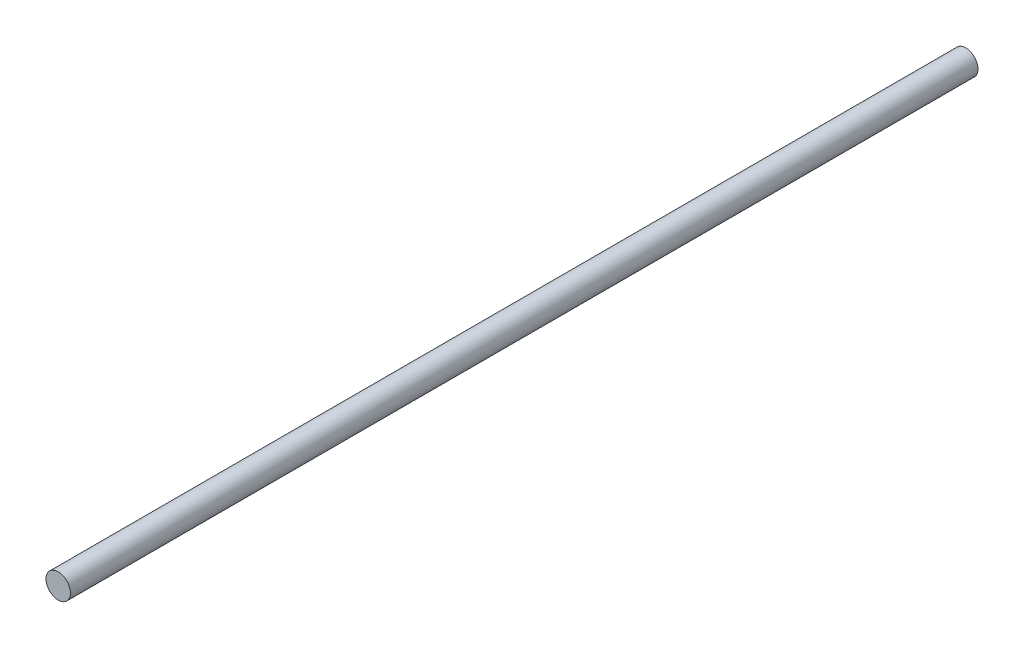
from build123d import *

# Parameters (mm, degrees)
SKETCH1_R           = 3
BOSS_EXTRUDE2_DEPTH = 4.5
SKETCH3_R           = 3
BOSS_EXTRUDE3_DEPTH = 201
SKETCH4_R           = 3
BOSS_EXTRUDE4_DEPTH = 17


with BuildPart() as part:
    # Sketch1 → Boss-Extrude2 (new body)
    with BuildSketch(Plane.XY):
        Circle(SKETCH1_R)
    extrude(amount=BOSS_EXTRUDE2_DEPTH)

    # Sketch3 → Boss-Extrude3 (add)
    with BuildSketch(Plane.XY.offset(4.5)):
        Circle(SKETCH3_R)
    extrude(amount=BOSS_EXTRUDE3_DEPTH)

    # Sketch4 → Boss-Extrude4 (add)
    with BuildSketch(Plane.XY.offset(205.5)):
        Circle(SKETCH4_R)
    extrude(amount=BOSS_EXTRUDE4_DEPTH)


solid = part.part
